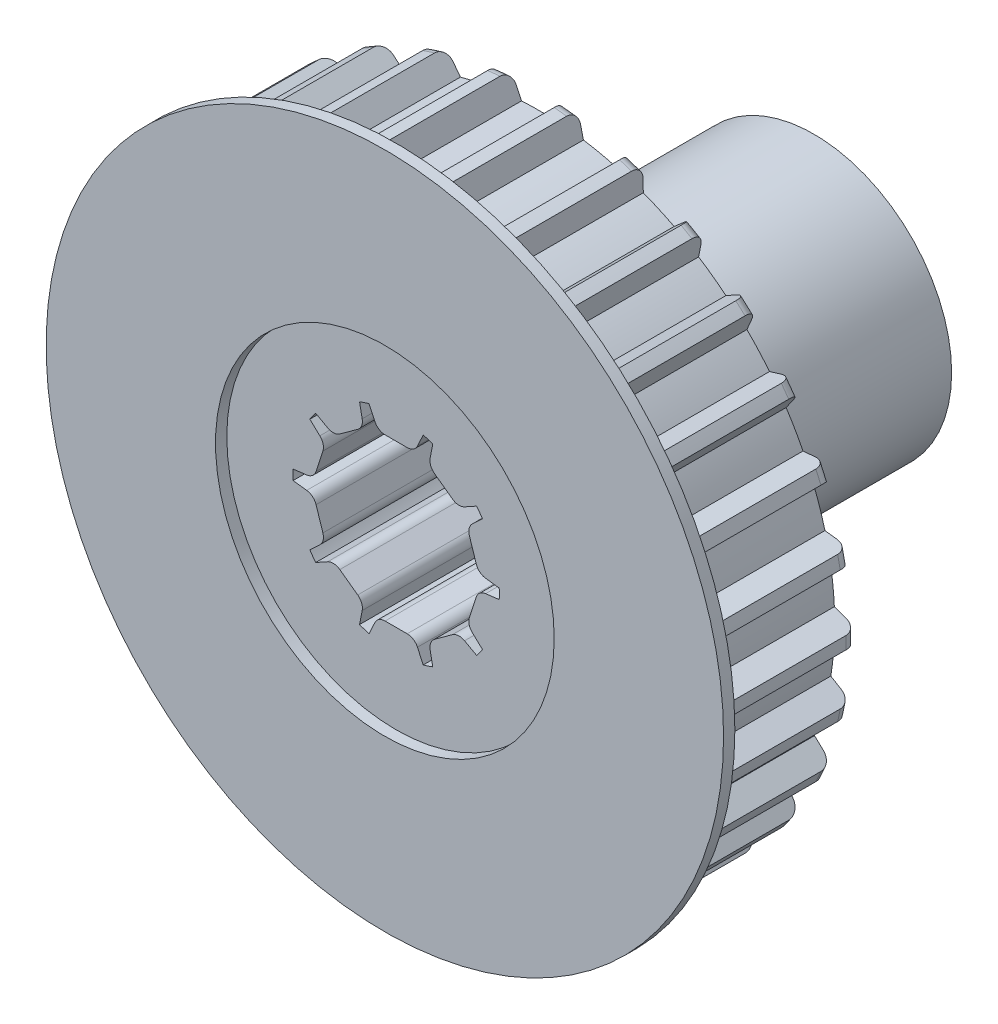
from build123d import *

# Parameters (mm, degrees)
SCHNITT_LINEAR_AUSTRAGEN1_DEPTH = 28.771186507
KREISMUSTER1_COUNT              = 30
AUFSATZ_LINEAR_AUSTRAGEN1_DEPTH = 19.3
VERRUNDUNG1_R                   = 0.5
KREISMUSTER2_COUNT              = 10
VERRUNDUNG1_OF_KREISMUSTER2_R   = 0.5
VERRUNDUNG2_R                   = 0.5


with BuildPart() as part:
    # Skizze1 → Rotation1 (revolve)
    with BuildSketch(Plane(origin=(0, 0, 0), x_dir=(0, 0, -1), z_dir=(1, 0, 0)), mode=Mode.PRIVATE) as rotation1_sk:
        with BuildLine():
            Line((0, 4.57), (0, 14.12))
            Line((0, 14.12), (5.8, 14.12))
            ThreePointArc((5.8, 14.12), (6.153553391, 13.973553391), (6.3, 13.62))
            Line((6.3, 13.62), (6.3, 6.1))
            Line((6.3, 6.1), (19.3, 6.1))
            Line((19.3, 6.1), (19.3, 4.57))
            Line((19.3, 4.57), (0, 4.57))
        make_face()
    revolve(rotation1_sk.sketch.rotate(Axis((0, 0, 33.276923077), (0, 0, -1)), 90), axis=Axis((0, 0, 33.276923077), (0, 0, -1)))

    # Skizze2 → Schnitt-Linear austragen1 (cut, through all)
    with BuildSketch(Plane.XY):
        with BuildLine():
            Line((0.747573546, 13.09868443), (1.2, 14.068916092))
            ThreePointArc((1.2, 14.068916092), (0, 14.12), (-1.2, 14.068916092))
            Line((-1.2, 14.068916092), (-0.747573546, 13.09868443))
            ThreePointArc((-0.747573546, 13.09868443), (0, 13.12), (0.747573546, 13.09868443))
        make_face()
    schnitt_linear_austragen1 = extrude(amount=-SCHNITT_LINEAR_AUSTRAGEN1_DEPTH, mode=Mode.SUBTRACT)

    # Kreismuster1: Schnitt-Linear austragen1 ×30 about axis
    kreismuster1_axis = Axis((0, 0, 0), (0, 0, 1))
    for i in range(1, KREISMUSTER1_COUNT):
        add(schnitt_linear_austragen1.rotate(kreismuster1_axis, i * 360 / KREISMUSTER1_COUNT), mode=Mode.SUBTRACT)

    # Skizze3 → Aufsatz-Linear austragen1 (add)
    with BuildSketch(Plane.XY):
        with BuildLine():
            Line((0.808470756, 3.57), (1.2, 4.409637173))
            ThreePointArc((1.2, 4.409637173), (0, 4.57), (-1.2, 4.409637173))
            Line((-1.2, 4.409637173), (-0.808470756, 3.57))
            Line((-0.808470756, 3.57), (0.808470756, 3.57))
        make_face()
    aufsatz_linear_austragen1 = extrude(amount=-AUFSATZ_LINEAR_AUSTRAGEN1_DEPTH)

    # Verrundung1
    verrundung1_edges = [part.edges().sort_by_distance(p)[0] for p in [
        (0.808470756, 3.57, -9.65),
        (-0.808470756, 3.57, -9.65),
    ]]
    fillet(verrundung1_edges, radius=VERRUNDUNG1_R)

    # Kreismuster2: Aufsatz-Linear austragen1 ×10 about axis
    kreismuster2_axis = Axis((0, 0, 0), (0, 0, 1))
    for i in range(1, KREISMUSTER2_COUNT):
        add(aufsatz_linear_austragen1.rotate(kreismuster2_axis, i * 360 / KREISMUSTER2_COUNT))

    # Verrundung1 of Kreismuster2
    verrundung1_of_kreismuster2_edges = [part.edges().sort_by_distance(p)[0] for p in [
        (-1.44432677, 3.363397857, -9.65),
        (-2.752459932, 2.412983483, -9.65),
        (-3.14544056, 1.872092051, -9.65),
        (-3.645102966, 0.334289289, -9.65),
        (-3.645102966, -0.334289289, -9.65),
        (-3.14544056, -1.872092051, -9.65),
        (-2.752459932, -2.412983483, -9.65),
        (-1.44432677, -3.363397857, -9.65),
        (-0.808470756, -3.57, -9.65),
        (0.808470756, -3.57, -9.65),
        (1.44432677, -3.363397857, -9.65),
        (2.752459932, -2.412983483, -9.65),
        (3.14544056, -1.872092051, -9.65),
        (3.645102966, -0.334289289, -9.65),
        (3.645102966, 0.334289289, -9.65),
        (3.14544056, 1.872092051, -9.65),
        (2.752459932, 2.412983483, -9.65),
        (1.44432677, 3.363397857, -9.65),
    ]]
    fillet(verrundung1_of_kreismuster2_edges, radius=VERRUNDUNG1_OF_KREISMUSTER2_R)

    # Skizze4 → Rotation2 (revolve)
    with BuildSketch(Plane(origin=(0, 0, 0), x_dir=(0, 0, -1), z_dir=(1, 0, 0)), mode=Mode.PRIVATE) as rotation2_sk:
        with BuildLine():
            Line((0, 7.5), (-0.5, 7.5))
            Line((-0.5, 7.5), (-0.5, 15))
            Line((-0.5, 15), (0, 15))
            Line((0, 15), (0, 14.25))
            Line((0, 14.25), (0.653553391, 13.596446609))
            ThreePointArc((0.653553391, 13.596446609), (0.761939766, 13.434234935), (0.8, 13.242893219))
            Line((0.8, 13.242893219), (0.8, 13))
            Line((0.8, 13), (0, 13))
            Line((0, 13), (0, 7.5))
        make_face()
    revolve(rotation2_sk.sketch.rotate(Axis((0, 0, 12.748207041), (0, 0, -1)), 90), axis=Axis((0, 0, 12.748207041), (0, 0, -1)))

    # Skizze5 → Schnitt-Rotation1 (revolve, cut)
    with BuildSketch(Plane(origin=(0, 0, 0), x_dir=(0, 0, -1), z_dir=(1, 0, 0)), mode=Mode.PRIVATE) as schnitt_rotation1_sk:
        Polygon((19.3, 4.2), (18.5, 5), (18.5, 6.1), (19.3, 6.1), align=None)
    revolve(schnitt_rotation1_sk.sketch.rotate(Axis((0, 0, -13.523679913), (0, 0, 1)), 270), axis=Axis((0, 0, -13.523679913), (0, 0, 1)), mode=Mode.SUBTRACT)

    # Verrundung2
    verrundung2_edges = [part.edges().sort_by_distance(p)[0] for p in [
        (2.46869806, 3.397871376, -19.3),
        (3.994437368, 1.297871376, -19.3),
        (3.994437368, -1.297871376, -19.3),
        (2.46869806, -3.397871376, -19.3),
        (0, -4.2, -19.3),
        (-2.46869806, -3.397871376, -19.3),
        (-3.994437368, -1.297871376, -19.3),
        (-3.994437368, 1.297871376, -19.3),
        (-2.46869806, 3.397871376, -19.3),
        (0, 4.2, -19.3),
    ]]
    fillet(verrundung2_edges, radius=VERRUNDUNG2_R)


solid = part.part
